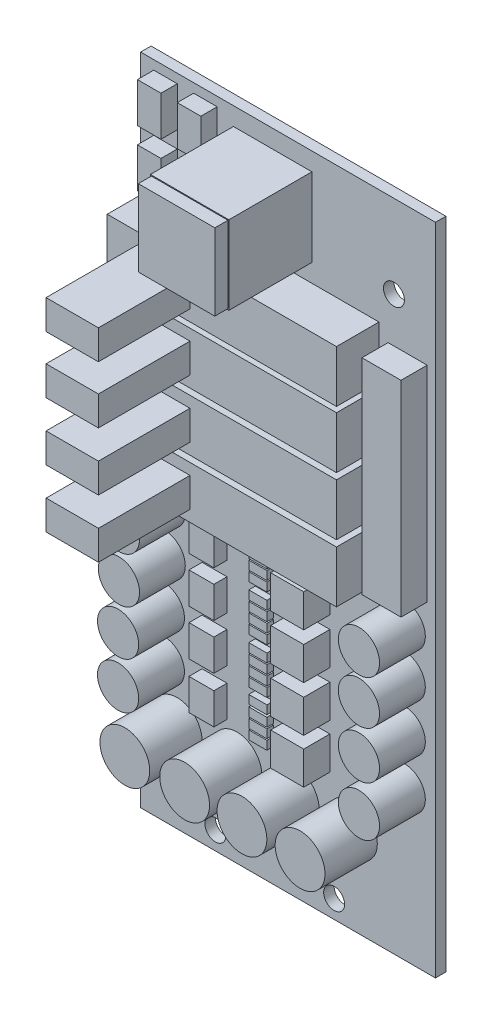
from build123d import *

# Parameters (mm, degrees)
SKETCH_2_W          = 45.085
SKETCH_2_H          = 100.076
EXTRUDE_1_DEPTH     = 1.6
SKETCH_3_W          = 3.6000436
SKETCH_3_H          = 6.0999624
EXTRUDE_2_DEPTH     = 2.5
SKETCH_4_W          = 35.0519492
SKETCH_4_H          = 7.9370174
EXTRUDE_3_DEPTH     = 6.5
SKETCH_5_W          = 8
SKETCH_5_H          = 4.5
EXTRUDE_4_DEPTH     = 14
SKETCH_6_W          = 11.999976
SKETCH_6_H          = 11.999976
EXTRUDE_5_DEPTH     = 12.7
SKETCH_8_W          = 11.69819953
SKETCH_8_H          = 11.69819953
EXTRUDE_8_DEPTH     = 2
SKETCH_9_R          = 1.599946
CUT_EXTRUDE_1_DEPTH = 2
SKETCH_10_R         = 3.81
EXTRUDE_9_DEPTH     = 8
SKETCH_11_W         = 5.969
SKETCH_11_H         = 31.369
EXTRUDE_10_DEPTH    = 4
SKETCH_12_W         = 3.81
SKETCH_12_H         = 4.800092
EXTRUDE_11_DEPTH    = 2
SKETCH_13_R         = 3.1496
EXTRUDE_12_DEPTH    = 7
SKETCH_14_W         = 2.7701748
SKETCH_14_H         = 1.3212064
EXTRUDE_13_DEPTH    = 1
SKETCH_15_W         = 5.0524156
SKETCH_15_H         = 5.0524156
EXTRUDE_14_DEPTH    = 4


with BuildPart() as part:
    # 草图2 → 凸台-拉伸1 (new body)
    with BuildSketch(Plane.XY):
        with Locations((22.5425, 50.038)):
            Rectangle(SKETCH_2_W, SKETCH_2_H)
    extrude(amount=EXTRUDE_1_DEPTH)

    # 草图3 → 凸台-拉伸2 (add)
    with BuildSketch(Plane.XY.offset(1.6)):
        with Locations((3.81, 95.631)):
            Rectangle(SKETCH_3_W, SKETCH_3_H)
        with Locations((9.906, 95.631)):
            Rectangle(SKETCH_3_W, SKETCH_3_H)
        with Locations((3.81, 86.995)):
            Rectangle(SKETCH_3_W, SKETCH_3_H)
        with Locations((9.906, 86.995)):
            Rectangle(SKETCH_3_W, SKETCH_3_H)
    extrude(amount=EXTRUDE_2_DEPTH)

    # 草图4 → 凸台-拉伸3 (add)
    with BuildSketch(Plane.XY.offset(1.6)):
        with Locations((18.923, 78.5815421)):
            Rectangle(SKETCH_4_W, SKETCH_4_H)
        with Locations((18.923, 69.8185421)):
            Rectangle(SKETCH_4_W, SKETCH_4_H)
        with Locations((18.923, 60.9285421)):
            Rectangle(SKETCH_4_W, SKETCH_4_H)
        with Locations((18.923, 52.0385421)):
            Rectangle(SKETCH_4_W, SKETCH_4_H)
    extrude(amount=EXTRUDE_3_DEPTH)

    # 草图5 → 凸台-拉伸4 (add)
    with BuildSketch(Plane.XY.offset(8.1)):
        with Locations((10.046059562, 78.5815421)):
            Rectangle(SKETCH_5_W, SKETCH_5_H)
        with Locations((10.047675227, 69.8185421)):
            Rectangle(SKETCH_5_W, SKETCH_5_H)
        with Locations((10.046401334, 60.9285421)):
            Rectangle(SKETCH_5_W, SKETCH_5_H)
        with Locations((10.054884801, 52.0385421)):
            Rectangle(SKETCH_5_W, SKETCH_5_H)
    extrude(amount=EXTRUDE_4_DEPTH)

    # 草图6 → 凸台-拉伸5 (add)
    with BuildSketch(Plane.XY.offset(1.6)):
        with Locations((20.193, 91.313)):
            Rectangle(SKETCH_6_W, SKETCH_6_H)
    extrude(amount=EXTRUDE_5_DEPTH)

    # 草图8 → 凸台-拉伸8 (add)
    with BuildSketch(Plane.XY.offset(14.3)):
        with Locations((20.198016327, 91.323022246)):
            Rectangle(SKETCH_8_W, SKETCH_8_H)
    extrude(amount=EXTRUDE_8_DEPTH)

    # 草图9 → 切除-拉伸1 (cut)
    with BuildSketch(Plane.XY.offset(1.6)):
        with Locations((38.735, 87.376)):
            Circle(SKETCH_9_R)
        with Locations((29.591, 2.794)):
            Circle(SKETCH_9_R)
        with Locations((11.43, 2.794)):
            Circle(SKETCH_9_R)
    extrude(amount=-CUT_EXTRUDE_1_DEPTH, mode=Mode.SUBTRACT)

    # 草图10 → 凸台-拉伸9 (add)
    with BuildSketch(Plane.XY.offset(1.6)):
        with Locations((5.588, 13.589)):
            Circle(SKETCH_10_R)
        with Locations((14.732, 13.589)):
            Circle(SKETCH_10_R)
        with Locations((23.495, 13.462)):
            Circle(SKETCH_10_R)
        with Locations((32.385, 13.335)):
            Circle(SKETCH_10_R)
    extrude(amount=EXTRUDE_9_DEPTH)

    # 草图11 → 凸台-拉伸10 (add)
    with BuildSketch(Plane.XY.offset(1.6)):
        with Locations((40.8305, 64.8335)):
            Rectangle(SKETCH_11_W, SKETCH_11_H)
    extrude(amount=EXTRUDE_10_DEPTH)

    # 草图12 → 凸台-拉伸11 (add)
    with BuildSketch(Plane.XY.offset(1.6)):
        with Locations((11.303, 41.783)):
            Rectangle(SKETCH_12_W, SKETCH_12_H)
        with Locations((11.303, 34.798)):
            Rectangle(SKETCH_12_W, SKETCH_12_H)
        with Locations((11.303, 27.813)):
            Rectangle(SKETCH_12_W, SKETCH_12_H)
        with Locations((11.303, 20.701)):
            Rectangle(SKETCH_12_W, SKETCH_12_H)
    extrude(amount=EXTRUDE_11_DEPTH)

    # 草图13 → 凸台-拉伸12 (add)
    with BuildSketch(Plane.XY.offset(1.6)):
        with Locations((3.683, 42.418)):
            Circle(SKETCH_13_R)
        with Locations((3.683, 35.433)):
            Circle(SKETCH_13_R)
        with Locations((3.556, 28.448)):
            Circle(SKETCH_13_R)
        with Locations((3.556, 21.336)):
            Circle(SKETCH_13_R)
        with Locations((40.386, 44.45)):
            Circle(SKETCH_13_R)
        with Locations((40.386, 37.719)):
            Circle(SKETCH_13_R)
        with Locations((40.386, 30.48)):
            Circle(SKETCH_13_R)
        with Locations((40.386, 22.86)):
            Circle(SKETCH_13_R)
    extrude(amount=EXTRUDE_12_DEPTH)

    # 草图14 → 凸台-拉伸13 (add)
    with BuildSketch(Plane.XY.offset(1.6)):
        with Locations((18.923, 44.45)):
            Rectangle(SKETCH_14_W, SKETCH_14_H)
        with Locations((18.923, 42.926)):
            Rectangle(SKETCH_14_W, SKETCH_14_H)
        with Locations((18.923, 41.402)):
            Rectangle(SKETCH_14_W, SKETCH_14_H)
        with Locations((18.923, 39.878)):
            Rectangle(SKETCH_14_W, SKETCH_14_H)
        with Locations((18.923, 37.465)):
            Rectangle(SKETCH_14_W, SKETCH_14_H)
        with Locations((18.923, 35.941)):
            Rectangle(SKETCH_14_W, SKETCH_14_H)
        with Locations((18.923, 34.417)):
            Rectangle(SKETCH_14_W, SKETCH_14_H)
        with Locations((18.923, 32.893)):
            Rectangle(SKETCH_14_W, SKETCH_14_H)
        with Locations((18.923, 30.48)):
            Rectangle(SKETCH_14_W, SKETCH_14_H)
        with Locations((18.923, 18.923)):
            Rectangle(SKETCH_14_W, SKETCH_14_H)
        with Locations((18.923, 20.447)):
            Rectangle(SKETCH_14_W, SKETCH_14_H)
        with Locations((18.923, 21.971)):
            Rectangle(SKETCH_14_W, SKETCH_14_H)
        with Locations((18.923, 23.622)):
            Rectangle(SKETCH_14_W, SKETCH_14_H)
        with Locations((18.923, 25.908)):
            Rectangle(SKETCH_14_W, SKETCH_14_H)
        with Locations((18.923, 27.432)):
            Rectangle(SKETCH_14_W, SKETCH_14_H)
        with Locations((18.923, 28.956)):
            Rectangle(SKETCH_14_W, SKETCH_14_H)
    extrude(amount=EXTRUDE_13_DEPTH)

    # 草图15 → 凸台-拉伸14 (add)
    with BuildSketch(Plane.XY.offset(1.6)):
        with Locations((26.416, 42.545)):
            Rectangle(SKETCH_15_W, SKETCH_15_H)
        with Locations((26.416, 35.56)):
            Rectangle(SKETCH_15_W, SKETCH_15_H)
        with Locations((26.416, 28.575)):
            Rectangle(SKETCH_15_W, SKETCH_15_H)
        with Locations((26.416, 21.717)):
            Rectangle(SKETCH_15_W, SKETCH_15_H)
    extrude(amount=EXTRUDE_14_DEPTH)


solid = part.part
